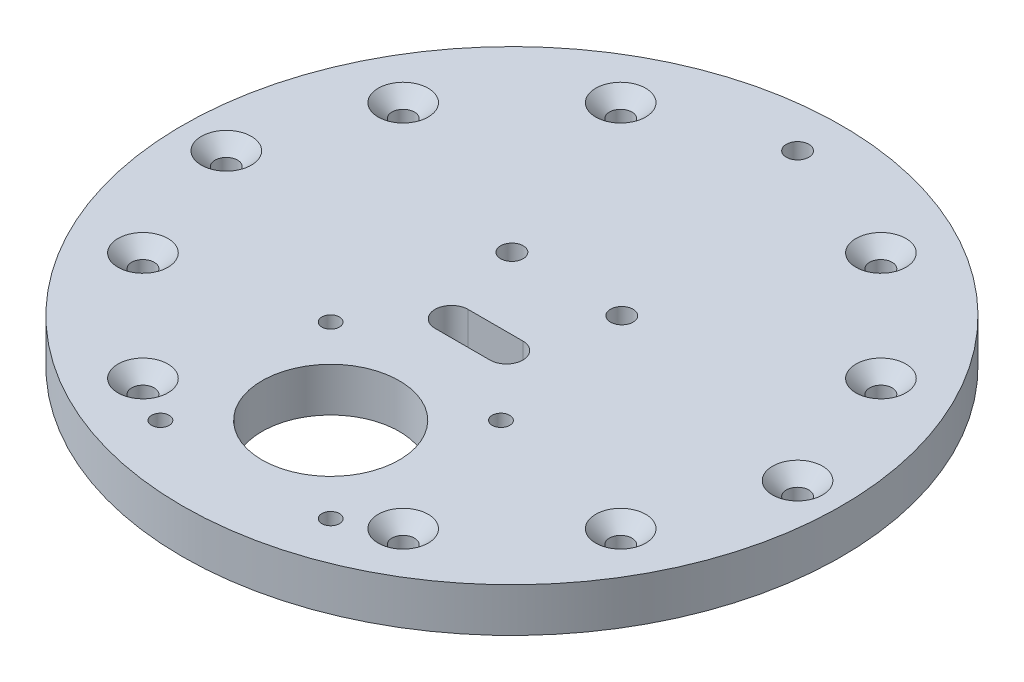
from build123d import *

# Parameters (mm, degrees)
SKETCH1_R                                           = 60
BOSS_EXTRUDE1_DEPTH                                 = 8
SKETCH2_R                                           = 12.5
SKETCH2_R_2                                         = 1.6
CUT_EXTRUDE1_DEPTH                                  = 86.229103011
SKETCH3_R                                           = 2.05
CUT_EXTRUDE2_DEPTH                                  = 86.229103011
CIRPATTERN1_COUNT                                   = 4
SKETCH4_R                                           = 2.05
CUT_EXTRUDE3_DEPTH                                  = 86.229103011
SKETCH5_R                                           = 2.05
CUT_EXTRUDE4_DEPTH                                  = 86.229103011
SKETCH6_W                                           = 8
SKETCH6_H                                           = 20
BOSS_EXTRUDE2_DEPTH                                 = 18
CHAMFER1_SIZE                                       = 5
SKETCH7_R                                           = 1.6
CUT_EXTRUDE5_DEPTH                                  = 93.455394651
CSK_FOR_M4_COUNTERSUNK_FLAT_HEAD_SCREW1_D           = 4.1
CSK_FOR_M4_COUNTERSUNK_FLAT_HEAD_SCREW1_DEPTH       = 7.999
CSK_FOR_M4_COUNTERSUNK_FLAT_HEAD_SCREW1_CSINK_D     = 9.1
CSK_FOR_M4_COUNTERSUNK_FLAT_HEAD_SCREW1_CSINK_ANGLE = 90
CSK_FOR_M4_COUNTERSUNK_FLAT_HEAD_SCREW1_TIP         = 1.231764269


with BuildPart() as part:
    # Sketch1 → Boss-Extrude1 (new body)
    with BuildSketch(Plane(origin=(0, 0, 0), x_dir=(1, 0, 0), z_dir=(0, 1, 0))):
        with Locations(Location((0, 0, 0), (0, 0, 270))):
            Circle(SKETCH1_R)
    extrude(amount=BOSS_EXTRUDE1_DEPTH)

    # Sketch2 → Cut-Extrude1 (cut, through all)
    with BuildSketch(Plane(origin=(0, 8, 0), x_dir=(1, 0, 0), z_dir=(0, 1, 0))):
        with Locations(Location((0, -33, 0), (0, 0, 270))):
            Circle(SKETCH2_R)
        with Locations(Location((-15.5, -48.5, 0), (0, 0, 270))):
            Circle(SKETCH2_R_2)
        with Locations(Location((15.5, -48.5, 0), (0, 0, 270))):
            Circle(SKETCH2_R_2)
        with Locations(Location((15.5, -17.5, 0), (0, 0, 270))):
            Circle(SKETCH2_R_2)
        with Locations(Location((-15.5, -17.5, 0), (0, 0, 270))):
            Circle(SKETCH2_R_2)
    extrude(amount=-CUT_EXTRUDE1_DEPTH, mode=Mode.SUBTRACT)

    # Sketch3 → Cut-Extrude2 (cut, through all)
    with BuildSketch(Plane(origin=(0, 8, 0), x_dir=(1, 0, 0), z_dir=(0, 1, 0))):
        with Locations(Location((-43.487067043, -23.68807717, 0), (0, 0, 270))):
            Circle(SKETCH3_R)
        with Locations(Location((-23.68807717, -43.487067043, 0), (0, 0, 270))):
            Circle(SKETCH3_R)
    cut_extrude2 = extrude(amount=-CUT_EXTRUDE2_DEPTH, mode=Mode.SUBTRACT)

    # CirPattern1: Cut-Extrude2 ×4 about axis
    cirpattern1_axis = Axis((0, 0, 0), (0, 1, 0))
    for i in range(1, CIRPATTERN1_COUNT):
        add(cut_extrude2.rotate(cirpattern1_axis, i * 360 / CIRPATTERN1_COUNT), mode=Mode.SUBTRACT)

    # Sketch4 → Cut-Extrude3 (cut, through all)
    with BuildSketch(Plane(origin=(0, 8, 0), x_dir=(1, 0, 0), z_dir=(0, 1, 0))):
        with Locations(Location((-52, 0, 0), (0, 0, 270))):
            Circle(SKETCH4_R)
        with Locations(Location((52, 0, 0), (0, 0, 270))):
            Circle(SKETCH4_R)
        with Locations(Location((0, 52, 0), (0, 0, 270))):
            Circle(SKETCH4_R)
    extrude(amount=-CUT_EXTRUDE3_DEPTH, mode=Mode.SUBTRACT)

    # Sketch5 → Cut-Extrude4 (cut, through all)
    with BuildSketch(Plane(origin=(0, 8, 0), x_dir=(1, 0, 0), z_dir=(0, 1, 0))):
        with Locations(Location((-10, 10, 0), (0, 0, 270))):
            Circle(SKETCH5_R)
        with Locations(Location((10, 10, 0), (0, 0, 270))):
            Circle(SKETCH5_R)
        with BuildLine():
            Line((-5, -3), (5, -3))
            ThreePointArc((5, -3), (8, -6), (5, -9))
            Line((5, -9), (-5, -9))
            ThreePointArc((-5, -9), (-8, -6), (-5, -3))
        make_face()
    extrude(amount=-CUT_EXTRUDE4_DEPTH, mode=Mode.SUBTRACT)

    # Sketch6 → Boss-Extrude2 (add)
    with BuildSketch(Plane.XZ):
        with Locations((4, -28)):
            Rectangle(SKETCH6_W, SKETCH6_H)
    extrude(amount=BOSS_EXTRUDE2_DEPTH)

    # Chamfer1
    chamfer1_edges = [part.edges().sort_by_distance(p)[0] for p in [
        (8, 0, -28),
    ]]
    chamfer(chamfer1_edges, length=CHAMFER1_SIZE)

    # Sketch7 → Cut-Extrude5 (cut, through all)
    with BuildSketch(Plane(origin=(8, 0, 0), x_dir=(0, 0, -1), z_dir=(1, 0, 0))):
        with Locations((23.25, -10.5)):
            Circle(SKETCH7_R)
        with Locations((32.75, -10.5)):
            Circle(SKETCH7_R)
    extrude(amount=-CUT_EXTRUDE5_DEPTH, mode=Mode.SUBTRACT)

    # CSK for M4 Countersunk Flat Head Screw1
    with Locations(Plane(origin=(-52, 8, 0), x_dir=(0, 0, 1), z_dir=(0, 1, 0))):
        with Locations((0, 0), (23.68807717, 8.512932957), (43.487067043, 28.31192283), (43.487067043, 75.68807717), (23.68807717, 95.487067043), (0, 104), (-23.68807717, 95.487067043), (-43.487067043, 75.68807717), (-43.487067043, 28.31192283), (-23.68807717, 8.512932957)):
            CounterSinkHole(CSK_FOR_M4_COUNTERSUNK_FLAT_HEAD_SCREW1_D / 2, CSK_FOR_M4_COUNTERSUNK_FLAT_HEAD_SCREW1_CSINK_D / 2, depth=CSK_FOR_M4_COUNTERSUNK_FLAT_HEAD_SCREW1_DEPTH, counter_sink_angle=CSK_FOR_M4_COUNTERSUNK_FLAT_HEAD_SCREW1_CSINK_ANGLE)
            with Locations((0, 0, -(CSK_FOR_M4_COUNTERSUNK_FLAT_HEAD_SCREW1_DEPTH + CSK_FOR_M4_COUNTERSUNK_FLAT_HEAD_SCREW1_TIP / 2))):  # 118° drill point
                Cone(0, CSK_FOR_M4_COUNTERSUNK_FLAT_HEAD_SCREW1_D / 2, CSK_FOR_M4_COUNTERSUNK_FLAT_HEAD_SCREW1_TIP, mode=Mode.SUBTRACT)


solid = part.part
